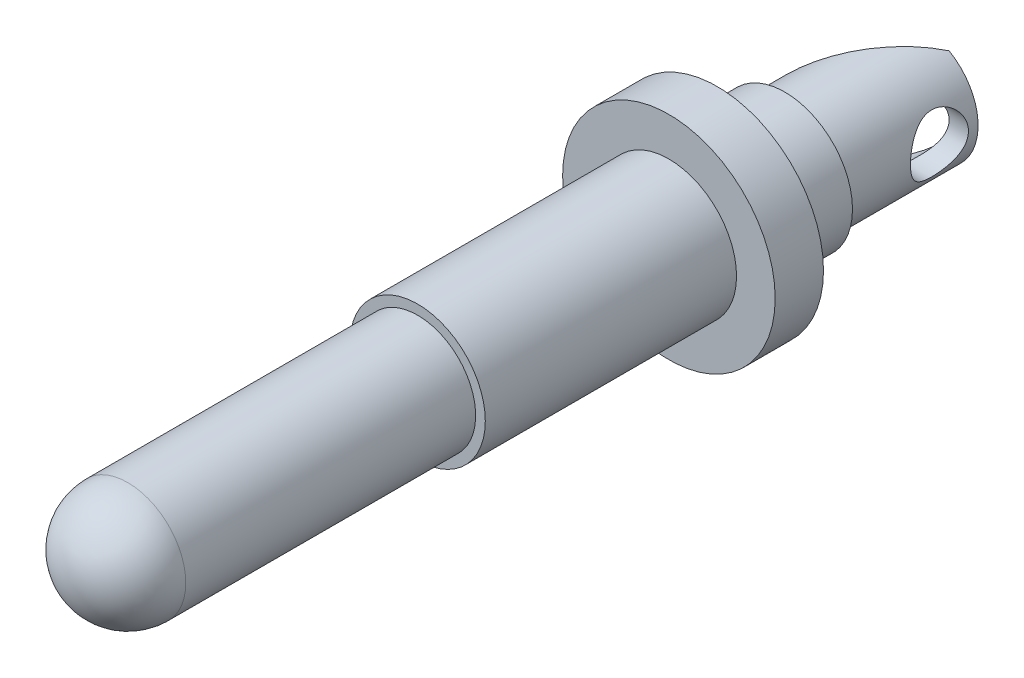
from build123d import *

# Parameters (mm, degrees)
SKETCH_1_R                = 3
EXTRUDE_1_DEPTH           = 15
DOME_1_FACE_RADIUS        = 3
DOME_1_HEIGHT             = 3
SKETCH_4_R                = 3.5
EXTRUDE_2_DEPTH           = 26
SKETCH_5_R                = 3.5
SKETCH_5_R_2              = 3
CUT_EXTRUDE_3_DEPTH       = 7
EXTRUDE_START             = -13
SKETCH_6_R                = 5.5
EXTRUDE_3_DEPTH           = 2.5
HOLE_WIZARD_4_0_4_1_D     = 4
HOLE_WIZARD_4_0_4_1_DEPTH = 7.5
HOLE_WIZARD_4_0_4_1_TIP   = 1.201721238
HOLE_WIZARD_3_0_3_1_D     = 3
HOLE_WIZARD_3_0_3_1_DEPTH = 9
HOLE_WIZARD_3_0_3_1_TIP   = 0.901290929
CUT_EXTRUDE_4_DEPTH       = 28.138533586
CUT_EXTRUDE_4_DEPTH_BACK  = 28.138533586


with BuildPart() as part:
    # Эскиз1 → Бобышка-Вытянуть1 (new body)
    with BuildSketch(Plane.XY):
        Circle(SKETCH_1_R)
    extrude(amount=EXTRUDE_1_DEPTH)

    # Купол1: a dome of height H over a round flat face of radius A is a cap of a sphere of radius (A * A + H * H) / (2 * H)
    dome_1_r = (DOME_1_FACE_RADIUS * DOME_1_FACE_RADIUS + DOME_1_HEIGHT * DOME_1_HEIGHT) / (2 * DOME_1_HEIGHT)
    dome_1_base = Plane((0, 0, 15), z_dir=(0, 0, 1))
    with Locations(dome_1_base.offset(DOME_1_HEIGHT - dome_1_r)):
        dome_1_ball = Sphere(dome_1_r, mode=Mode.PRIVATE)
    add(split(dome_1_ball, bisect_by=dome_1_base, keep=Keep.TOP, mode=Mode.PRIVATE))

    # Эскиз4 → Бобышка-Вытянуть2 (add)
    with BuildSketch(Plane(origin=(0, 0, 0), x_dir=(-1, 0, 0), z_dir=(0, 0, -1))):
        with Locations(Location((0, 0, 0), (0, 0, 180))):
            Circle(SKETCH_4_R)
    extrude(amount=EXTRUDE_2_DEPTH)

    # Эскиз5 → Вырез-Вытянуть3 (cut)
    with BuildSketch(Plane(origin=(0, 0, -26), x_dir=(-1, 0, 0), z_dir=(0, 0, -1))):
        with Locations(Location((0, 0, 0), (0, 0, 180))):
            Circle(SKETCH_5_R)
        Circle(SKETCH_5_R_2, mode=Mode.SUBTRACT)
    extrude(amount=-CUT_EXTRUDE_3_DEPTH, mode=Mode.SUBTRACT)

    # Эскиз6 → Бобышка-Вытянуть3 (add)
    with BuildSketch(Plane.XY.offset(EXTRUDE_START)):
        Circle(SKETCH_6_R)
    extrude(amount=-EXTRUDE_3_DEPTH)

    # Диаметр отверстия Ø4.0 (4)1
    with Locations(Plane(origin=(0, 0, -26), x_dir=(-1, 0, 0), z_dir=(0, 0, -1))):
        with Locations((0, 0)):
            Hole(HOLE_WIZARD_4_0_4_1_D / 2, depth=HOLE_WIZARD_4_0_4_1_DEPTH)
            with Locations((0, 0, -(HOLE_WIZARD_4_0_4_1_DEPTH + HOLE_WIZARD_4_0_4_1_TIP / 2))):  # 118° drill point
                Cone(0, HOLE_WIZARD_4_0_4_1_D / 2, HOLE_WIZARD_4_0_4_1_TIP, mode=Mode.SUBTRACT)

    # Диаметр отверстия Ø3.0 (3)1
    with Locations(Plane(origin=(-3, 0, -24), x_dir=(0, 0, -1), z_dir=(-1, 0, 0))):
        with Locations((0, 0)):
            Hole(HOLE_WIZARD_3_0_3_1_D / 2, depth=HOLE_WIZARD_3_0_3_1_DEPTH)
            with Locations((0, 0, -(HOLE_WIZARD_3_0_3_1_DEPTH + HOLE_WIZARD_3_0_3_1_TIP / 2))):  # 118° drill point
                Cone(0, HOLE_WIZARD_3_0_3_1_D / 2, HOLE_WIZARD_3_0_3_1_TIP, mode=Mode.SUBTRACT)

    # Эскиз12 → Вырез-Вытянуть4 (cut, two sides: drawn at the far end of the back side and taken through both)
    with BuildSketch(Plane(origin=(0, 0, 0), x_dir=(1, 0, 0), z_dir=(0, 1, 0)).offset(-CUT_EXTRUDE_4_DEPTH_BACK)):
        Polygon((1.5, 26), (-3, 20), (-3, 26), align=None)
    extrude(amount=CUT_EXTRUDE_4_DEPTH + CUT_EXTRUDE_4_DEPTH_BACK, mode=Mode.SUBTRACT)


solid = part.part
